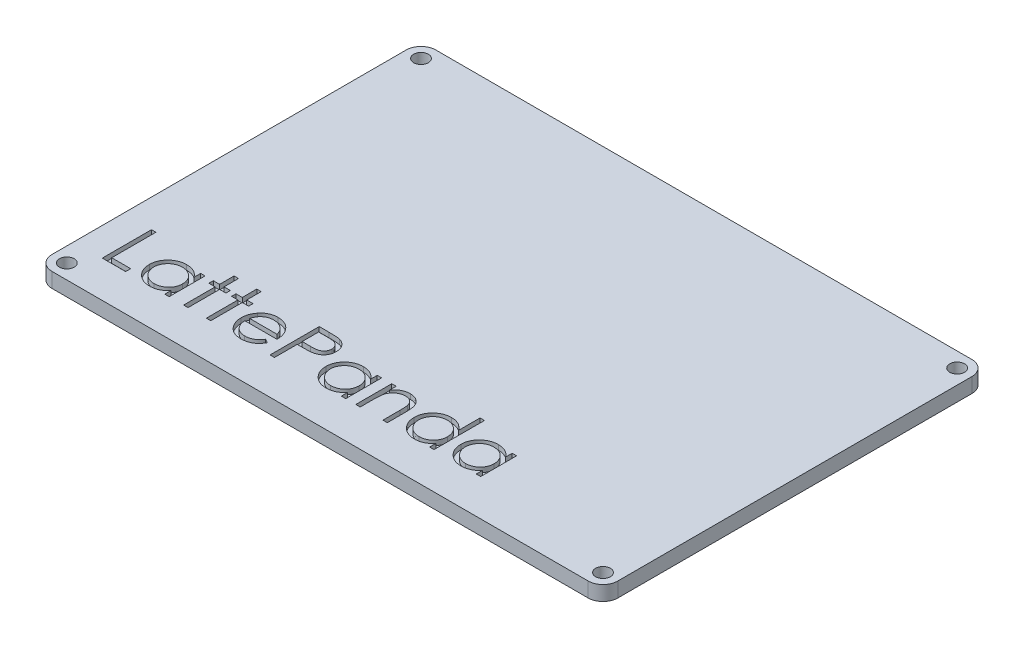
from build123d import *

# Parameters (mm, degrees)
SKETCH1_R           = 1.5
BOSS_EXTRUDE1_DEPTH = 3
CUT_EXTRUDE1_DEPTH  = 1


with BuildPart() as part:
    # Sketch1 → Boss-Extrude1 (new body)
    with BuildSketch(Plane(origin=(0, 0, 0), x_dir=(1, 0, 0), z_dir=(0, 1, 0))):
        with BuildLine():
            Line((-54.5, 39), (54.5, 39))
            ThreePointArc((54.5, 39), (56.621320344, 38.121320344), (57.5, 36))
            Line((57.5, 36), (57.5, -36))
            ThreePointArc((57.5, -36), (56.621320344, -38.121320344), (54.5, -39))
            Line((54.5, -39), (-54.5, -39))
            ThreePointArc((-54.5, -39), (-56.621320344, -38.121320344), (-57.5, -36))
            Line((-57.5, -36), (-57.5, 36))
            ThreePointArc((-57.5, 36), (-56.621320344, 38.121320344), (-54.5, 39))
        make_face()
        with Locations(Location((-54.5, 36, 0), (0, 0, 270))):
            Circle(SKETCH1_R, mode=Mode.SUBTRACT)
        with Locations(Location((54.5, 36, 0), (0, 0, 270))):
            Circle(SKETCH1_R, mode=Mode.SUBTRACT)
        with Locations(Location((54.5, -36, 0), (0, 0, 270))):
            Circle(SKETCH1_R, mode=Mode.SUBTRACT)
        with Locations(Location((-54.5, -36, 0), (0, 0, 270))):
            Circle(SKETCH1_R, mode=Mode.SUBTRACT)
    extrude(amount=BOSS_EXTRUDE1_DEPTH)

    # Sketch2 → Cut-Extrude1 (cut)
    # profile 1 of 10: a face of its own
    with BuildSketch(Plane(origin=(0, 3, 0), x_dir=(1, 0, 0), z_dir=(0, 1, 0))):
        Polygon((-51.748795713, -21.544641821), (-50.851359815, -21.544641821), (-50.851359815, -30.519000795), (-47.005205969, -30.519000795), (-47.005205969, -31.544641821), (-51.748795713, -31.544641821), align=None)
    # profile 2 of 10: a face of its own
    with BuildSketch(Plane(origin=(0, 3, 0), x_dir=(1, 0, 0), z_dir=(0, 1, 0))):
        with BuildLine():
            Line((-38.159052123, -24.236949513), (-38.159052123, -31.544641821))
            Line((-38.159052123, -31.544641821), (-39.056488021, -31.544641821))
            Line((-39.056488021, -31.544641821), (-39.056488021, -30.280619385))
            add(Edge.make_bspline(
                [(-39.056488021, -30.280619385), (-39.157684565, -30.395018224), (-39.355170895, -30.618268999), (-39.68500266, -30.909932349), (-40.034626026, -31.151013268), (-40.402344086, -31.345727313), (-40.787824781, -31.491990331), (-41.190213602, -31.595950785), (-41.60967469, -31.662790314), (-41.89610999, -31.669464663), (-42.041263662, -31.672846949)],
                knots=[0, 0, 0, 0, 1.074387032, 2.096679803, 3.090159297, 4.057316773, 5.018401886, 5.985159533, 6.978961417, 8, 8, 8, 8], degree=3))
            add(Edge.make_bspline(
                [(-42.041263662, -31.672846949), (-42.170314958, -31.669343028), (-42.424809829, -31.662433141), (-42.799178621, -31.608826559), (-43.159442191, -31.522739069), (-43.50594097, -31.403022242), (-43.836432814, -31.244219894), (-44.153747376, -31.054102043), (-44.456240782, -30.827699671), (-44.739302322, -30.568876733), (-44.99996518, -30.287748198), (-45.228711673, -29.987903778), (-45.419434758, -29.670640053), (-45.578920703, -29.339973899), (-45.701767402, -28.993359843), (-45.787406357, -28.631996506), (-45.84095049, -28.256311153), (-45.847857521, -28.000483944), (-45.851359815, -27.870763615)],
                knots=[0, 0, 0, 0, 1.033919861, 2.038935746, 3.024066025, 3.998881131, 4.97069526, 5.957263378, 6.95902576, 7.993208707, 9.027059324, 10.027763471, 11.009749337, 11.988697705, 12.965288445, 13.950418724, 14.960734635, 16, 16, 16, 16], degree=3))
            add(Edge.make_bspline(
                [(-45.851359815, -27.870763615), (-45.847779897, -27.743724462), (-45.840702592, -27.49257491), (-45.787979107, -27.123207201), (-45.699319082, -26.767440742), (-45.57489666, -26.426420904), (-45.415348217, -26.099735047), (-45.221267969, -25.787152118), (-44.992641898, -25.487810983), (-44.729063592, -25.208750335), (-44.443535678, -24.950977151), (-44.138082161, -24.726951307), (-43.820301357, -24.533474596), (-43.485264184, -24.380178949), (-43.137929599, -24.256152936), (-42.775205468, -24.170344456), (-42.398600958, -24.119780681), (-42.142913837, -24.112458498), (-42.01321879, -24.108744385)],
                knots=[0, 0, 0, 0, 1.020392517, 2.01726096, 2.990465484, 3.961182959, 4.928053699, 5.906110375, 6.912531644, 7.948652711, 8.985773172, 9.998621852, 10.987621588, 11.969261332, 12.953316658, 13.946091881, 14.958173133, 16, 16, 16, 16], degree=3))
            add(Edge.make_bspline(
                [(-42.01321879, -24.108744385), (-41.864076335, -24.112852246), (-41.571615021, -24.120907569), (-41.143820709, -24.187943933), (-40.739122201, -24.301196696), (-40.354395481, -24.45524669), (-39.991022092, -24.659957345), (-39.652442136, -24.918185805), (-39.335112184, -25.228303482), (-39.151168494, -25.466504752), (-39.056488021, -25.589112974)],
                knots=[0, 0, 0, 0, 1.038897134, 2.037228247, 3.008116434, 3.962042015, 4.918381754, 5.904844433, 6.921570401, 8, 8, 8, 8], degree=3))
            Line((-39.056488021, -25.589112974), (-39.056488021, -24.236949513))
            Line((-39.056488021, -24.236949513), (-38.159052123, -24.236949513))
        make_face()
        with BuildLine():
            add(Edge.make_bspline(
                [(-42.001199559, -25.006180282), (-42.132383381, -25.010847818), (-42.391319381, -25.020060793), (-42.771445102, -25.091985065), (-43.135197713, -25.211655334), (-43.480757925, -25.375317909), (-43.802667116, -25.581114299), (-44.090363318, -25.830032537), (-44.346199608, -26.115281149), (-44.561366077, -26.435572893), (-44.736767497, -26.778938868), (-44.860101874, -27.137865834), (-44.941442581, -27.505880055), (-44.949752639, -27.755487729), (-44.953923918, -27.880779641)],
                knots=[0, 0, 0, 0, 1.031046209, 2.035121221, 3.029706178, 4.034933723, 5.034054252, 6.02443088, 7.017295772, 8.038157696, 9.050218397, 10.03989886, 11.016116709, 12, 12, 12, 12], degree=3))
            add(Edge.make_bspline(
                [(-44.953923918, -27.880779641), (-44.948595651, -28.005322804), (-44.937960003, -28.253920964), (-44.861529448, -28.622436898), (-44.733301238, -28.981448446), (-44.558323916, -29.327908428), (-44.339219274, -29.649577286), (-44.085251695, -29.940263351), (-43.793965177, -30.190233603), (-43.471315157, -30.399483813), (-43.126720956, -30.568519587), (-42.764338294, -30.6861357), (-42.390979328, -30.762072216), (-42.137115517, -30.77094215), (-42.00921238, -30.775411051)],
                knots=[0, 0, 0, 0, 0.979072187, 1.954306742, 2.945804271, 3.96968567, 4.997920485, 5.998718438, 6.996577872, 8.005894225, 9.015743152, 10.005417472, 10.995077863, 12, 12, 12, 12], degree=3))
            add(Edge.make_bspline(
                [(-42.00921238, -30.775411051), (-41.879365229, -30.770668297), (-41.621112124, -30.76123543), (-41.239858673, -30.689003243), (-40.869873065, -30.569663819), (-40.51619527, -30.404237743), (-40.18672061, -30.199216726), (-39.891012388, -29.959196466), (-39.640966764, -29.680044511), (-39.428987879, -29.373254646), (-39.262772403, -29.036934656), (-39.141697948, -28.678836968), (-39.07011536, -28.298949116), (-39.061093276, -28.039337896), (-39.056488021, -27.906821308)],
                knots=[0, 0, 0, 0, 1.01762866, 2.023962475, 3.030623092, 4.058876274, 5.077231937, 6.066672613, 7.034107872, 8.005628644, 8.981990164, 9.965428785, 10.961468474, 12, 12, 12, 12], degree=3))
            add(Edge.make_bspline(
                [(-39.056488021, -27.906821308), (-39.059229896, -27.805856078), (-39.064626774, -27.607124554), (-39.105856973, -27.315331646), (-39.171442477, -27.036092429), (-39.263860106, -26.769113318), (-39.385263775, -26.515870417), (-39.531685964, -26.274545387), (-39.705701534, -26.046393355), (-39.904509237, -25.834556009), (-40.122124102, -25.641337546), (-40.352394218, -25.468868286), (-40.598047781, -25.327186079), (-40.8549536, -25.209925303), (-41.123557413, -25.116613446), (-41.406044898, -25.054362892), (-41.699413432, -25.011619118), (-41.899545019, -25.008012316), (-42.001199559, -25.006180282)],
                knots=[0, 0, 0, 0, 1.050140795, 2.067009409, 3.05949893, 4.030605086, 5.00011959, 5.97591094, 6.962425594, 7.979863591, 8.993523472, 9.986985069, 10.967611495, 11.937549037, 12.921786183, 13.919465291, 14.943216303, 16, 16, 16, 16], degree=3))
        make_face(mode=Mode.SUBTRACT)
    # profile 3 of 10: a face of its own
    with BuildSketch(Plane(origin=(0, 3, 0), x_dir=(1, 0, 0), z_dir=(0, 1, 0))):
        Polygon((-35.210334174, -21.288231564), (-34.312898277, -21.288231564), (-34.312898277, -24.236949513), (-33.030846995, -24.236949513), (-33.030846995, -25.13438541), (-34.312898277, -25.13438541), (-34.312898277, -31.544641821), (-35.210334174, -31.544641821), (-35.210334174, -25.13438541), (-36.492385456, -25.13438541), (-36.492385456, -24.236949513), (-35.210334174, -24.236949513), align=None)
    # profile 4 of 10: a face of its own
    with BuildSketch(Plane(origin=(0, 3, 0), x_dir=(1, 0, 0), z_dir=(0, 1, 0))):
        Polygon((-30.594949559, -21.288231564), (-29.697513662, -21.288231564), (-29.697513662, -24.236949513), (-28.41546238, -24.236949513), (-28.41546238, -25.13438541), (-29.697513662, -25.13438541), (-29.697513662, -31.544641821), (-30.594949559, -31.544641821), (-30.594949559, -25.13438541), (-31.877000841, -25.13438541), (-31.877000841, -24.236949513), (-30.594949559, -24.236949513), align=None)
    # profile 5 of 10: a face of its own
    with BuildSketch(Plane(origin=(0, 3, 0), x_dir=(1, 0, 0), z_dir=(0, 1, 0))):
        with BuildLine():
            Line((-20.879404687, -29.236949513), (-20.082129046, -29.655619385))
            add(Edge.make_bspline(
                [(-20.082129046, -29.655619385), (-20.145662175, -29.768314617), (-20.269272485, -29.987574911), (-20.481846051, -30.288808798), (-20.704680544, -30.559802271), (-20.947834738, -30.793315569), (-21.204033821, -30.996890955), (-21.474698549, -31.174999026), (-21.761238028, -31.326766227), (-22.063665813, -31.454630592), (-22.384521674, -31.552943432), (-22.724583149, -31.622384064), (-23.084501707, -31.665307688), (-23.331205078, -31.670293805), (-23.457529687, -31.672846949)],
                knots=[0, 0, 0, 0, 1.120438281, 2.179929193, 3.190490725, 4.156257408, 5.095198341, 6.022838206, 6.959905092, 7.901321166, 8.864066838, 9.862729781, 10.905609505, 12, 12, 12, 12], degree=3))
            add(Edge.make_bspline(
                [(-23.457529687, -31.672846949), (-23.597935337, -31.669569305), (-23.871826085, -31.663175571), (-24.270511077, -31.608054244), (-24.645880844, -31.51813322), (-24.997914282, -31.392517387), (-25.325749289, -31.228439318), (-25.630037446, -31.028555084), (-25.912378948, -30.793891499), (-26.163876689, -30.522415947), (-26.390287782, -30.231896069), (-26.590075839, -29.92916497), (-26.757097071, -29.614984329), (-26.892961671, -29.29135426), (-27.002689857, -28.960314564), (-27.079166153, -28.618853228), (-27.123251148, -28.267894416), (-27.130006706, -28.030473457), (-27.133411097, -27.910827718)],
                knots=[0, 0, 0, 0, 1.145258523, 2.234067595, 3.276747158, 4.290159414, 5.277019952, 6.260822364, 7.254936242, 8.264827045, 9.274100331, 10.257902744, 11.220704747, 12.172965371, 13.118907548, 14.062713208, 15.023725156, 16, 16, 16, 16], degree=3))
            add(Edge.make_bspline(
                [(-27.133411097, -27.910827718), (-27.130384979, -27.798556774), (-27.124387613, -27.576050589), (-27.086585363, -27.246720462), (-27.01959024, -26.926639169), (-26.927657886, -26.615540746), (-26.80894004, -26.313946078), (-26.663705128, -26.02167161), (-26.491726906, -25.739028353), (-26.358947838, -25.560733686), (-26.292064944, -25.470923872)],
                knots=[0, 0, 0, 0, 1.024358464, 2.0301432, 3.019427413, 4.004406732, 4.986367066, 5.972626655, 6.978780325, 8, 8, 8, 8], degree=3))
            add(Edge.make_bspline(
                [(-26.292064944, -25.470923872), (-26.201471564, -25.3627271), (-26.023154574, -25.149760956), (-25.721564987, -24.869937168), (-25.394992998, -24.635526382), (-25.047531209, -24.441220279), (-24.675141283, -24.293581287), (-24.282829023, -24.183559624), (-23.866127348, -24.121908164), (-23.581255288, -24.113200067), (-23.435494431, -24.108744385)],
                knots=[0, 0, 0, 0, 1.030682036, 2.02871468, 2.997146059, 3.962720338, 4.930598197, 5.918074684, 6.934738563, 8, 8, 8, 8], degree=3))
            add(Edge.make_bspline(
                [(-23.435494431, -24.108744385), (-23.28564413, -24.112613096), (-22.991671999, -24.120202625), (-22.563008796, -24.190563578), (-22.157406748, -24.302142305), (-21.775028165, -24.459724564), (-21.415834277, -24.663037569), (-21.082159849, -24.914871401), (-20.768298385, -25.207494508), (-20.585702445, -25.432532249), (-20.492786097, -25.547045667)],
                knots=[0, 0, 0, 0, 1.056321875, 2.072262726, 3.055038591, 4.01806755, 4.982017516, 5.957941055, 6.960871419, 8, 8, 8, 8], degree=3))
            add(Edge.make_bspline(
                [(-20.492786097, -25.547045667), (-20.429566274, -25.633341613), (-20.303547436, -25.805359095), (-20.145698579, -26.085848116), (-20.008677451, -26.379306957), (-19.899154705, -26.690479234), (-19.810470416, -27.015678035), (-19.746308076, -27.357228162), (-19.708680595, -27.715027909), (-19.701284317, -27.958818068), (-19.697513662, -28.083103359)],
                knots=[0, 0, 0, 0, 0.94817472, 1.890038105, 2.849395472, 3.817997239, 4.812318967, 5.836947057, 6.897266129, 8, 8, 8, 8], degree=3))
            Line((-19.697513662, -28.083103359), (-26.2359752, -28.083103359))
            add(Edge.make_bspline(
                [(-26.2359752, -28.083103359), (-26.231576325, -28.1793904), (-26.222926113, -28.368734982), (-26.182597133, -28.645794362), (-26.119029208, -28.909718197), (-26.029689029, -29.158526888), (-25.921498042, -29.39547011), (-25.788967423, -29.618790215), (-25.630854412, -29.827470015), (-25.454495271, -30.023376123), (-25.258189284, -30.19783544), (-25.051667149, -30.353983373), (-24.831971249, -30.484856506), (-24.600833868, -30.591084762), (-24.358628767, -30.674245666), (-24.105279638, -30.731010867), (-23.84128502, -30.769031173), (-23.66132578, -30.773258788), (-23.569709174, -30.775411051)],
                knots=[0, 0, 0, 0, 1.094153842, 2.151609401, 3.174256925, 4.172055639, 5.149267565, 6.128595816, 7.11444997, 8.118368179, 9.117203808, 10.09244225, 11.054858984, 12.015122123, 12.976791628, 13.957293641, 14.960065497, 16, 16, 16, 16], degree=3))
            add(Edge.make_bspline(
                [(-23.569709174, -30.775411051), (-23.480134467, -30.773673747), (-23.302401064, -30.770226601), (-23.0377129, -30.736706855), (-22.777314251, -30.682506068), (-22.52228287, -30.608534667), (-22.277794739, -30.51831509), (-22.051378881, -30.409449782), (-21.843149694, -30.289021935), (-21.648529789, -30.151280006), (-21.459755523, -29.982685186), (-21.272491276, -29.772297412), (-21.071700838, -29.523475904), (-20.946016287, -29.336202572), (-20.879404687, -29.236949513)],
                knots=[0, 0, 0, 0, 0.99110716, 1.966546729, 2.947904876, 3.932708344, 4.903319531, 5.828989031, 6.710028674, 7.56322171, 8.463672341, 9.504779593, 10.677557249, 12, 12, 12, 12], degree=3))
        make_face()
        with BuildLine():
            add(Edge.make_bspline(
                [(-20.594949559, -27.185667462), (-20.627797058, -27.066630679), (-20.691017919, -26.837523192), (-20.823121818, -26.520263505), (-20.971897648, -26.238298074), (-21.147959738, -25.993784836), (-21.347441811, -25.776631942), (-21.577856619, -25.586864556), (-21.836244886, -25.41710041), (-22.121271002, -25.273807554), (-22.423104674, -25.151836529), (-22.739122365, -25.070050484), (-23.061573187, -25.014023221), (-23.279671148, -25.008805768), (-23.389420713, -25.006180282)],
                knots=[0, 0, 0, 0, 1.154881502, 2.222775134, 3.210006277, 4.132804581, 5.035138423, 5.962687519, 6.919655026, 7.923214229, 8.944639381, 9.960483929, 10.97369054, 12, 12, 12, 12], degree=3))
            add(Edge.make_bspline(
                [(-23.389420713, -25.006180282), (-23.478990537, -25.007927915), (-23.656051249, -25.011382618), (-23.916911444, -25.044154416), (-24.167424869, -25.098325401), (-24.409439977, -25.172510992), (-24.639785315, -25.271392713), (-24.863198938, -25.387344789), (-25.07400007, -25.528892172), (-25.205832343, -25.636774614), (-25.272433533, -25.691276436)],
                knots=[0, 0, 0, 0, 1.04873581, 2.073130211, 3.073294108, 4.04793562, 5.032784715, 6.005352987, 6.992311501, 8, 8, 8, 8], degree=3))
            add(Edge.make_bspline(
                [(-25.272433533, -25.691276436), (-25.320128625, -25.734403052), (-25.416651865, -25.821680812), (-25.545624784, -25.972049974), (-25.669111849, -26.134197294), (-25.781493714, -26.314326222), (-25.884572532, -26.51038559), (-25.98102961, -26.720721691), (-26.06784793, -26.946930634), (-26.116693959, -27.104566175), (-26.141824559, -27.185667462)],
                knots=[0, 0, 0, 0, 0.879870761, 1.780643979, 2.707998968, 3.669668524, 4.684282772, 5.740141944, 6.837334558, 8, 8, 8, 8], degree=3))
            Line((-26.141824559, -27.185667462), (-20.594949559, -27.185667462))
        make_face(mode=Mode.SUBTRACT)
    # profile 6 of 10: a face of its own
    with BuildSketch(Plane(origin=(0, 3, 0), x_dir=(1, 0, 0), z_dir=(0, 1, 0))):
        with BuildLine():
            Line((-17.64623161, -21.544641821), (-15.68509379, -21.544641821))
            add(Edge.make_bspline(
                [(-15.68509379, -21.544641821), (-15.550205486, -21.544790095), (-15.291753507, -21.545074197), (-14.921139062, -21.553687756), (-14.584539829, -21.565192591), (-14.282681598, -21.581140857), (-14.014635603, -21.599988258), (-13.781614747, -21.626422656), (-13.581787444, -21.654023501), (-13.462054731, -21.682084662), (-13.407449559, -21.694882205)],
                knots=[0, 0, 0, 0, 1.415646017, 2.712440637, 3.8905458, 4.950247383, 5.884950622, 6.709939814, 7.411656543, 8, 8, 8, 8], degree=3))
            add(Edge.make_bspline(
                [(-13.407449559, -21.694882205), (-13.338325177, -21.713802062), (-13.201705242, -21.751195952), (-13.004845119, -21.826092305), (-12.817548417, -21.914898491), (-12.639172536, -22.016109748), (-12.471909442, -22.134068503), (-12.31326361, -22.263993125), (-12.164635095, -22.408883321), (-12.02685969, -22.567114006), (-11.900331697, -22.736028892), (-11.791389746, -22.918149548), (-11.700169097, -23.110410415), (-11.621931179, -23.312677762), (-11.565621309, -23.526650114), (-11.523201595, -23.750840721), (-11.496276945, -23.98522555), (-11.493698197, -24.1453966), (-11.492385456, -24.226933487)],
                knots=[0, 0, 0, 0, 0.999701418, 1.975846123, 2.934577507, 3.890451536, 4.834027766, 5.787354733, 6.749476667, 7.726910423, 8.712836071, 9.690891519, 10.682875813, 11.679750201, 12.712814741, 13.765529915, 14.8625177, 16, 16, 16, 16], degree=3))
            add(Edge.make_bspline(
                [(-11.492385456, -24.226933487), (-11.493589527, -24.309155707), (-11.495945373, -24.470029032), (-11.524220474, -24.705379856), (-11.562306735, -24.930289542), (-11.620869742, -25.1442594), (-11.697571665, -25.346018744), (-11.787548959, -25.538650836), (-11.896073331, -25.71887847), (-12.020772845, -25.887355948), (-12.159491686, -26.044241412), (-12.311642938, -26.188397968), (-12.476612345, -26.318981792), (-12.653875625, -26.436285631), (-12.845160908, -26.537589287), (-13.047567061, -26.628324444), (-13.262853393, -26.704527474), (-13.411832005, -26.744613364), (-13.487577764, -26.764994385)],
                knots=[0, 0, 0, 0, 1.121902311, 2.195077645, 3.232258892, 4.234102512, 5.217864754, 6.176164875, 7.132989551, 8.084763148, 9.034132444, 9.988522005, 10.94243251, 11.903244335, 12.886203696, 13.894208494, 14.929344452, 16, 16, 16, 16], degree=3))
            add(Edge.make_bspline(
                [(-13.487577764, -26.764994385), (-13.55022729, -26.778317188), (-13.687527368, -26.807514885), (-13.913649431, -26.840110476), (-14.176921963, -26.867932193), (-14.476985619, -26.888792586), (-14.813571062, -26.906650781), (-15.186860369, -26.920845335), (-15.597586304, -26.928644918), (-15.884075572, -26.929047183), (-16.033651482, -26.929257205)],
                knots=[0, 0, 0, 0, 0.601384939, 1.31797006, 2.144135048, 3.087295005, 4.142315834, 5.309527816, 6.595305764, 8, 8, 8, 8], degree=3))
            Line((-16.033651482, -26.929257205), (-16.748795713, -26.929257205))
            Line((-16.748795713, -26.929257205), (-16.748795713, -31.544641821))
            Line((-16.748795713, -31.544641821), (-17.64623161, -31.544641821))
            Line((-17.64623161, -31.544641821), (-17.64623161, -21.544641821))
        make_face()
        with BuildLine():
            Line((-16.748795713, -22.570282846), (-16.748795713, -25.903616179))
            Line((-16.748795713, -25.903616179), (-14.997994431, -25.925651436))
            add(Edge.make_bspline(
                [(-14.997994431, -25.925651436), (-14.912508928, -25.925695618), (-14.747480929, -25.925780909), (-14.509091719, -25.914394557), (-14.287922327, -25.901250178), (-14.084652112, -25.882004682), (-13.899189442, -25.854801089), (-13.731225074, -25.827338981), (-13.582061408, -25.787609373), (-13.40749226, -25.73411489), (-13.21296841, -25.642878845), (-13.001346843, -25.510450588), (-12.822002311, -25.341648565), (-12.666807177, -25.151854761), (-12.543647526, -24.940714391), (-12.453487548, -24.714803143), (-12.400512812, -24.476437859), (-12.393409402, -24.313328891), (-12.389821354, -24.230939897)],
                knots=[0, 0, 0, 0, 1.160613943, 2.240541288, 3.23993089, 4.169200891, 5.011653406, 5.7853311, 6.478053781, 7.106038997, 8.262395093, 9.384106736, 10.481365981, 11.59014053, 12.70357646, 13.786202915, 14.881775077, 16, 16, 16, 16], degree=3))
            add(Edge.make_bspline(
                [(-12.389821354, -24.230939897), (-12.393428915, -24.150544145), (-12.400600301, -23.990727339), (-12.453902767, -23.756502308), (-12.543472235, -23.532971724), (-12.667633934, -23.324477195), (-12.818322877, -23.135366326), (-12.993463857, -22.97108882), (-13.192644604, -22.839026813), (-13.377925264, -22.753788865), (-13.542500081, -22.701745221), (-13.685448538, -22.665331391), (-13.846850465, -22.63625823), (-14.026758406, -22.612716794), (-14.223777932, -22.592564047), (-14.439601688, -22.578889827), (-14.673412098, -22.570885666), (-14.835728015, -22.570488651), (-14.919869431, -22.570282846)],
                knots=[0, 0, 0, 0, 1.120700087, 2.227813068, 3.331159281, 4.466773991, 5.599788987, 6.693661531, 7.80175334, 8.91857717, 9.525282508, 10.207424825, 10.974604443, 11.810962634, 12.737642355, 13.736264703, 14.826523623, 16, 16, 16, 16], degree=3))
            Line((-14.919869431, -22.570282846), (-16.748795713, -22.570282846))
        make_face(mode=Mode.SUBTRACT)
    # profile 7 of 10: a face of its own
    with BuildSketch(Plane(origin=(0, 3, 0), x_dir=(1, 0, 0), z_dir=(0, 1, 0))):
        with BuildLine():
            Line((-2.261616226, -24.236949513), (-2.261616226, -31.544641821))
            Line((-2.261616226, -31.544641821), (-3.159052123, -31.544641821))
            Line((-3.159052123, -31.544641821), (-3.159052123, -30.280619385))
            add(Edge.make_bspline(
                [(-3.159052123, -30.280619385), (-3.260248668, -30.395018224), (-3.457734997, -30.618268999), (-3.787566763, -30.909932349), (-4.137190128, -31.151013268), (-4.504908189, -31.345727313), (-4.890388884, -31.491990331), (-5.292777705, -31.595950785), (-5.712238793, -31.662790314), (-5.998674092, -31.669464663), (-6.143827764, -31.672846949)],
                knots=[0, 0, 0, 0, 1.074387032, 2.096679803, 3.090159297, 4.057316773, 5.018401886, 5.985159533, 6.978961417, 8, 8, 8, 8], degree=3))
            add(Edge.make_bspline(
                [(-6.143827764, -31.672846949), (-6.272879061, -31.669343028), (-6.527373932, -31.662433141), (-6.901742724, -31.608826559), (-7.262006294, -31.522739069), (-7.608505073, -31.403022242), (-7.938996917, -31.244219894), (-8.256311479, -31.054102043), (-8.558804884, -30.827699671), (-8.841866424, -30.568876733), (-9.102529283, -30.287748198), (-9.331275776, -29.987903778), (-9.521998861, -29.670640053), (-9.681484806, -29.339973899), (-9.804331504, -28.993359843), (-9.889970459, -28.631996506), (-9.943514593, -28.256311153), (-9.950421623, -28.000483944), (-9.953923918, -27.870763615)],
                knots=[0, 0, 0, 0, 1.033919861, 2.038935746, 3.024066025, 3.998881131, 4.97069526, 5.957263378, 6.95902576, 7.993208707, 9.027059324, 10.027763471, 11.009749337, 11.988697705, 12.965288445, 13.950418724, 14.960734635, 16, 16, 16, 16], degree=3))
            add(Edge.make_bspline(
                [(-9.953923918, -27.870763615), (-9.950344, -27.743724462), (-9.943266694, -27.49257491), (-9.890543209, -27.123207201), (-9.801883184, -26.767440742), (-9.677460763, -26.426420904), (-9.51791232, -26.099735047), (-9.323832071, -25.787152118), (-9.095206001, -25.487810983), (-8.831627695, -25.208750335), (-8.54609978, -24.950977151), (-8.240646263, -24.726951307), (-7.922865459, -24.533474596), (-7.587828287, -24.380178949), (-7.240493701, -24.256152936), (-6.877769571, -24.170344456), (-6.50116506, -24.119780681), (-6.24547794, -24.112458498), (-6.115782892, -24.108744385)],
                knots=[0, 0, 0, 0, 1.020392517, 2.01726096, 2.990465484, 3.961182959, 4.928053699, 5.906110375, 6.912531644, 7.948652711, 8.985773172, 9.998621852, 10.987621588, 11.969261332, 12.953316658, 13.946091881, 14.958173133, 16, 16, 16, 16], degree=3))
            add(Edge.make_bspline(
                [(-6.115782892, -24.108744385), (-5.966640438, -24.112852246), (-5.674179124, -24.120907569), (-5.246384811, -24.187943933), (-4.841686303, -24.301196696), (-4.456959583, -24.45524669), (-4.093586194, -24.659957345), (-3.755006239, -24.918185805), (-3.437676287, -25.228303482), (-3.253732596, -25.466504752), (-3.159052123, -25.589112974)],
                knots=[0, 0, 0, 0, 1.038897134, 2.037228247, 3.008116434, 3.962042015, 4.918381754, 5.904844433, 6.921570401, 8, 8, 8, 8], degree=3))
            Line((-3.159052123, -25.589112974), (-3.159052123, -24.236949513))
            Line((-3.159052123, -24.236949513), (-2.261616226, -24.236949513))
        make_face()
        with BuildLine():
            add(Edge.make_bspline(
                [(-6.103763662, -25.006180282), (-6.234947484, -25.010847818), (-6.493883484, -25.020060793), (-6.874009204, -25.091985065), (-7.237761816, -25.211655334), (-7.583322028, -25.375317909), (-7.905231218, -25.581114299), (-8.192927421, -25.830032537), (-8.44876371, -26.115281149), (-8.66393018, -26.435572893), (-8.839331599, -26.778938868), (-8.962665976, -27.137865834), (-9.044006683, -27.505880055), (-9.052316742, -27.755487729), (-9.056488021, -27.880779641)],
                knots=[0, 0, 0, 0, 1.031046209, 2.035121221, 3.029706178, 4.034933723, 5.034054252, 6.02443088, 7.017295772, 8.038157696, 9.050218397, 10.03989886, 11.016116709, 12, 12, 12, 12], degree=3))
            add(Edge.make_bspline(
                [(-9.056488021, -27.880779641), (-9.051159754, -28.005322804), (-9.040524106, -28.253920964), (-8.96409355, -28.622436898), (-8.835865341, -28.981448446), (-8.660888018, -29.327908428), (-8.441783376, -29.649577286), (-8.187815798, -29.940263351), (-7.89652928, -30.190233603), (-7.573879259, -30.399483813), (-7.229285058, -30.568519587), (-6.866902397, -30.6861357), (-6.493543431, -30.762072216), (-6.23967962, -30.77094215), (-6.111776482, -30.775411051)],
                knots=[0, 0, 0, 0, 0.979072187, 1.954306742, 2.945804271, 3.96968567, 4.997920485, 5.998718438, 6.996577872, 8.005894225, 9.015743152, 10.005417472, 10.995077863, 12, 12, 12, 12], degree=3))
            add(Edge.make_bspline(
                [(-6.111776482, -30.775411051), (-5.981929331, -30.770668297), (-5.723676227, -30.76123543), (-5.342422776, -30.689003243), (-4.972437168, -30.569663819), (-4.618759373, -30.404237743), (-4.289284712, -30.199216726), (-3.99357649, -29.959196466), (-3.743530866, -29.680044511), (-3.531551982, -29.373254646), (-3.365336506, -29.036934656), (-3.244262051, -28.678836968), (-3.172679463, -28.298949116), (-3.163657378, -28.039337896), (-3.159052123, -27.906821308)],
                knots=[0, 0, 0, 0, 1.01762866, 2.023962475, 3.030623092, 4.058876274, 5.077231937, 6.066672613, 7.034107872, 8.005628644, 8.981990164, 9.965428785, 10.961468474, 12, 12, 12, 12], degree=3))
            add(Edge.make_bspline(
                [(-3.159052123, -27.906821308), (-3.161793998, -27.805856078), (-3.167190877, -27.607124554), (-3.208421075, -27.315331646), (-3.27400658, -27.036092429), (-3.366424208, -26.769113318), (-3.487827878, -26.515870417), (-3.634250066, -26.274545387), (-3.808265637, -26.046393355), (-4.00707334, -25.834556009), (-4.224688204, -25.641337546), (-4.45495832, -25.468868286), (-4.700611883, -25.327186079), (-4.957517703, -25.209925303), (-5.226121516, -25.116613446), (-5.508609001, -25.054362892), (-5.801977535, -25.011619118), (-6.002109122, -25.008012316), (-6.103763662, -25.006180282)],
                knots=[0, 0, 0, 0, 1.050140795, 2.067009409, 3.05949893, 4.030605086, 5.00011959, 5.97591094, 6.962425594, 7.979863591, 8.993523472, 9.986985069, 10.967611495, 11.937549037, 12.921786183, 13.919465291, 14.943216303, 16, 16, 16, 16], degree=3))
        make_face(mode=Mode.SUBTRACT)
    # profile 8 of 10: a face of its own
    with BuildSketch(Plane(origin=(0, 3, 0), x_dir=(1, 0, 0), z_dir=(0, 1, 0))):
        with BuildLine():
            Line((-0.210334174, -24.236949513), (0.687101723, -24.236949513))
            Line((0.687101723, -24.236949513), (0.687101723, -25.555058487))
            add(Edge.make_bspline(
                [(0.687101723, -25.555058487), (0.782923538, -25.435507851), (0.968869112, -25.203515669), (1.278538636, -24.898599742), (1.605806922, -24.64732767), (1.94866979, -24.447031116), (2.307592676, -24.296040756), (2.680387733, -24.186995238), (3.069286893, -24.121610014), (3.333756712, -24.113066499), (3.467550441, -24.108744385)],
                knots=[0, 0, 0, 0, 1.12780773, 2.188550248, 3.19190651, 4.159438251, 5.104880172, 6.052711206, 7.014878035, 8, 8, 8, 8], degree=3))
            add(Edge.make_bspline(
                [(3.467550441, -24.108744385), (3.602780824, -24.113730657), (3.867459304, -24.123489996), (4.252825193, -24.200680542), (4.612749175, -24.332524128), (4.945947906, -24.513130043), (5.246311373, -24.737719967), (5.510096663, -24.999370772), (5.728277369, -25.30033101), (5.874555549, -25.579540028), (5.970914543, -25.827222297), (6.031578364, -26.039355869), (6.083095454, -26.275693444), (6.127757591, -26.535520841), (6.157977911, -26.820658527), (6.18181303, -27.129937648), (6.198895013, -27.46325802), (6.199572748, -27.693791242), (6.199922236, -27.812670667)],
                knots=[0, 0, 0, 0, 1.235846778, 2.418850247, 3.575807741, 4.728682307, 5.871620074, 6.994088408, 8.11269785, 9.256955736, 9.865816715, 10.540099792, 11.271859618, 12.076849838, 12.949306005, 13.892391288, 14.913166135, 16, 16, 16, 16], degree=3))
            Line((6.199922236, -27.812670667), (6.199922236, -31.544641821))
            Line((6.199922236, -31.544641821), (5.302486338, -31.544641821))
            Line((5.302486338, -31.544641821), (5.302486338, -28.107141821))
            add(Edge.make_bspline(
                [(5.302486338, -28.107141821), (5.301934316, -28.007649121), (5.30087839, -27.817336519), (5.297547971, -27.544853595), (5.289519952, -27.297749085), (5.278239058, -27.07661375), (5.261727542, -26.881659931), (5.244520024, -26.712490569), (5.223477233, -26.569320448), (5.204726052, -26.483134498), (5.196316467, -26.444481564)],
                knots=[0, 0, 0, 0, 1.430800155, 2.736877192, 3.918605307, 4.986035426, 5.920637409, 6.731861385, 7.431261377, 8, 8, 8, 8], degree=3))
            add(Edge.make_bspline(
                [(5.196316467, -26.444481564), (5.165957805, -26.331021036), (5.107526775, -26.112644622), (4.963143966, -25.816432186), (4.780817735, -25.564437364), (4.558252451, -25.358218159), (4.297597949, -25.197730055), (3.999577541, -25.086375898), (3.667067139, -25.016729415), (3.433197475, -25.009794752), (3.311300441, -25.006180282)],
                knots=[0, 0, 0, 0, 1.084156227, 2.086665306, 3.027808233, 3.945421172, 4.874247719, 5.839848303, 6.874090471, 8, 8, 8, 8], degree=3))
            add(Edge.make_bspline(
                [(3.311300441, -25.006180282), (3.239107059, -25.007540295), (3.096238222, -25.010231727), (2.88438116, -25.037235435), (2.678883522, -25.081402451), (2.477682925, -25.14102713), (2.284803514, -25.222919328), (2.094048396, -25.315860385), (1.912600499, -25.43171242), (1.736590793, -25.560828481), (1.572839914, -25.70391193), (1.420473233, -25.854896245), (1.284650318, -26.015683684), (1.16159696, -26.183683534), (1.05537335, -26.361203071), (0.962650241, -26.546529661), (0.883976828, -26.739907229), (0.844883421, -26.87412169), (0.825322877, -26.941276436)],
                knots=[0, 0, 0, 0, 1.023777757, 2.026029729, 3.023749952, 4.003683103, 4.997618607, 5.993177895, 7.010360494, 8.046726602, 9.087585522, 10.09234134, 11.086953743, 12.070360549, 13.043493632, 14.017870808, 15.008233677, 16, 16, 16, 16], degree=3))
            add(Edge.make_bspline(
                [(0.825322877, -26.941276436), (0.814066738, -26.990577016), (0.789562713, -27.0979018), (0.763096485, -27.274028713), (0.739074841, -27.477771498), (0.718969245, -27.708892404), (0.706668055, -27.968200619), (0.693255492, -28.254588727), (0.688372461, -28.569198694), (0.687537164, -28.788232101), (0.687101723, -28.902414256)],
                knots=[0, 0, 0, 0, 0.615963638, 1.340920617, 2.168419149, 3.115676021, 4.16674242, 5.331190069, 6.6087489, 8, 8, 8, 8], degree=3))
            Line((0.687101723, -28.902414256), (0.687101723, -31.544641821))
            Line((0.687101723, -31.544641821), (-0.210334174, -31.544641821))
            Line((-0.210334174, -31.544641821), (-0.210334174, -24.236949513))
        make_face()
    # profile 9 of 10: a face of its own
    with BuildSketch(Plane(origin=(0, 3, 0), x_dir=(1, 0, 0), z_dir=(0, 1, 0))):
        with BuildLine():
            Line((15.687101723, -21.288231564), (15.687101723, -31.544641821))
            Line((15.687101723, -31.544641821), (14.789665826, -31.544641821))
            Line((14.789665826, -31.544641821), (14.789665826, -30.280619385))
            add(Edge.make_bspline(
                [(14.789665826, -30.280619385), (14.688469281, -30.395018224), (14.490982952, -30.618268999), (14.161151186, -30.909932349), (13.811527821, -31.151013268), (13.44380976, -31.345727313), (13.058329065, -31.491990331), (12.655940244, -31.595950785), (12.236479156, -31.662790314), (11.950043857, -31.669464663), (11.804890185, -31.672846949)],
                knots=[0, 0, 0, 0, 1.074387032, 2.096679803, 3.090159297, 4.057316773, 5.018401886, 5.985159533, 6.978961417, 8, 8, 8, 8], degree=3))
            add(Edge.make_bspline(
                [(11.804890185, -31.672846949), (11.675838888, -31.669343028), (11.421344017, -31.662433141), (11.046975225, -31.608826559), (10.686711655, -31.522739069), (10.340212876, -31.403022242), (10.009721032, -31.244219894), (9.69240647, -31.054102043), (9.389913064, -30.827699671), (9.106851524, -30.568876733), (8.846188666, -30.287748198), (8.617442173, -29.987903778), (8.426719088, -29.670640053), (8.267233143, -29.339973899), (8.144386444, -28.993359843), (8.058747489, -28.631996506), (8.005203356, -28.256311153), (7.998296325, -28.000483944), (7.994794031, -27.870763615)],
                knots=[0, 0, 0, 0, 1.033919861, 2.038935746, 3.024066025, 3.998881131, 4.97069526, 5.957263378, 6.95902576, 7.993208707, 9.027059324, 10.027763471, 11.009749337, 11.988697705, 12.965288445, 13.950418724, 14.960734635, 16, 16, 16, 16], degree=3))
            add(Edge.make_bspline(
                [(7.994794031, -27.870763615), (7.998373949, -27.743724462), (8.005451254, -27.49257491), (8.058174739, -27.123207201), (8.146834764, -26.767440742), (8.271257186, -26.426420904), (8.430805629, -26.099735047), (8.624885878, -25.787152118), (8.853511948, -25.487810983), (9.117090254, -25.208750335), (9.402618169, -24.950977151), (9.708071685, -24.726951307), (10.025852489, -24.533474596), (10.360889662, -24.380178949), (10.708224247, -24.256152936), (11.070948378, -24.170344456), (11.447552889, -24.119780681), (11.703240009, -24.112458498), (11.832935056, -24.108744385)],
                knots=[0, 0, 0, 0, 1.020392517, 2.01726096, 2.990465484, 3.961182959, 4.928053699, 5.906110375, 6.912531644, 7.948652711, 8.985773172, 9.998621852, 10.987621588, 11.969261332, 12.953316658, 13.946091881, 14.958173133, 16, 16, 16, 16], degree=3))
            add(Edge.make_bspline(
                [(11.832935056, -24.108744385), (11.982125936, -24.113221802), (12.274971052, -24.122010474), (12.703252542, -24.195457237), (13.108360001, -24.318779745), (13.492625679, -24.487611978), (13.853758708, -24.707042695), (14.194406253, -24.972046832), (14.508644318, -25.290124392), (14.694563811, -25.529014602), (14.789665826, -25.651212333)],
                knots=[0, 0, 0, 0, 1.031072012, 2.023879775, 2.993683497, 3.952812103, 4.918022106, 5.908088563, 6.929940113, 8, 8, 8, 8], degree=3))
            Line((14.789665826, -25.651212333), (14.789665826, -21.288231564))
            Line((14.789665826, -21.288231564), (15.687101723, -21.288231564))
        make_face()
        with BuildLine():
            add(Edge.make_bspline(
                [(11.844954287, -25.006180282), (11.713770465, -25.010847818), (11.454834465, -25.020060793), (11.074708745, -25.091985065), (10.710956133, -25.211655334), (10.365395921, -25.375317909), (10.04348673, -25.581114299), (9.755790528, -25.830032537), (9.499954238, -26.115281149), (9.284787769, -26.435572893), (9.109386349, -26.778938868), (8.986051972, -27.137865834), (8.904711266, -27.505880055), (8.896401207, -27.755487729), (8.892229928, -27.880779641)],
                knots=[0, 0, 0, 0, 1.031046209, 2.035121221, 3.029706178, 4.034933723, 5.034054252, 6.02443088, 7.017295772, 8.038157696, 9.050218397, 10.03989886, 11.016116709, 12, 12, 12, 12], degree=3))
            add(Edge.make_bspline(
                [(8.892229928, -27.880779641), (8.897558195, -28.005322804), (8.908193843, -28.253920964), (8.984624398, -28.622436898), (9.112852608, -28.981448446), (9.28782993, -29.327908428), (9.506934572, -29.649577286), (9.760902151, -29.940263351), (10.052188669, -30.190233603), (10.374838689, -30.399483813), (10.71943289, -30.568519587), (11.081815552, -30.6861357), (11.455174518, -30.762072216), (11.709038329, -30.77094215), (11.836941467, -30.775411051)],
                knots=[0, 0, 0, 0, 0.979072187, 1.954306742, 2.945804271, 3.96968567, 4.997920485, 5.998718438, 6.996577872, 8.005894225, 9.015743152, 10.005417472, 10.995077863, 12, 12, 12, 12], degree=3))
            add(Edge.make_bspline(
                [(11.836941467, -30.775411051), (11.966788617, -30.770668297), (12.225041722, -30.76123543), (12.606295173, -30.689003243), (12.976280781, -30.569663819), (13.329958576, -30.404237743), (13.659433237, -30.199216726), (13.955141458, -29.959196466), (14.205187082, -29.680044511), (14.417165967, -29.373254646), (14.583381443, -29.036934656), (14.704455898, -28.678836968), (14.776038486, -28.298949116), (14.785060571, -28.039337896), (14.789665826, -27.906821308)],
                knots=[0, 0, 0, 0, 1.01762866, 2.023962475, 3.030623092, 4.058876274, 5.077231937, 6.066672613, 7.034107872, 8.005628644, 8.981990164, 9.965428785, 10.961468474, 12, 12, 12, 12], degree=3))
            add(Edge.make_bspline(
                [(14.789665826, -27.906821308), (14.78692395, -27.805856078), (14.781527072, -27.607124554), (14.740296873, -27.315331646), (14.674711369, -27.036092429), (14.582293741, -26.769113318), (14.460890071, -26.515870417), (14.314467883, -26.274545387), (14.140452312, -26.046393355), (13.941644609, -25.834556009), (13.724029744, -25.641337546), (13.493759628, -25.468868286), (13.248106066, -25.327186079), (12.991200246, -25.209925303), (12.722596433, -25.116613446), (12.440108948, -25.054362892), (12.146740414, -25.011619118), (11.946608827, -25.008012316), (11.844954287, -25.006180282)],
                knots=[0, 0, 0, 0, 1.050140795, 2.067009409, 3.05949893, 4.030605086, 5.00011959, 5.97591094, 6.962425594, 7.979863591, 8.993523472, 9.986985069, 10.967611495, 11.937549037, 12.921786183, 13.919465291, 14.943216303, 16, 16, 16, 16], degree=3))
        make_face(mode=Mode.SUBTRACT)
    # profile 10 of 10: a face of its own
    with BuildSketch(Plane(origin=(0, 3, 0), x_dir=(1, 0, 0), z_dir=(0, 1, 0))):
        with BuildLine():
            Line((25.17428121, -24.236949513), (25.17428121, -31.544641821))
            Line((25.17428121, -31.544641821), (24.276845313, -31.544641821))
            Line((24.276845313, -31.544641821), (24.276845313, -30.280619385))
            add(Edge.make_bspline(
                [(24.276845313, -30.280619385), (24.175648768, -30.395018224), (23.978162439, -30.618268999), (23.648330673, -30.909932349), (23.298707308, -31.151013268), (22.930989247, -31.345727313), (22.545508552, -31.491990331), (22.143119731, -31.595950785), (21.723658643, -31.662790314), (21.437223344, -31.669464663), (21.292069672, -31.672846949)],
                knots=[0, 0, 0, 0, 1.074387032, 2.096679803, 3.090159297, 4.057316773, 5.018401886, 5.985159533, 6.978961417, 8, 8, 8, 8], degree=3))
            add(Edge.make_bspline(
                [(21.292069672, -31.672846949), (21.163018375, -31.669343028), (20.908523504, -31.662433141), (20.534154712, -31.608826559), (20.173891142, -31.522739069), (19.827392363, -31.403022242), (19.496900519, -31.244219894), (19.179585957, -31.054102043), (18.877092551, -30.827699671), (18.594031012, -30.568876733), (18.333368153, -30.287748198), (18.10462166, -29.987903778), (17.913898575, -29.670640053), (17.75441263, -29.339973899), (17.631565932, -28.993359843), (17.545926977, -28.631996506), (17.492382843, -28.256311153), (17.485475813, -28.000483944), (17.481973518, -27.870763615)],
                knots=[0, 0, 0, 0, 1.033919861, 2.038935746, 3.024066025, 3.998881131, 4.97069526, 5.957263378, 6.95902576, 7.993208707, 9.027059324, 10.027763471, 11.009749337, 11.988697705, 12.965288445, 13.950418724, 14.960734635, 16, 16, 16, 16], degree=3))
            add(Edge.make_bspline(
                [(17.481973518, -27.870763615), (17.485553436, -27.743724462), (17.492630741, -27.49257491), (17.545354227, -27.123207201), (17.634014251, -26.767440742), (17.758436673, -26.426420904), (17.917985116, -26.099735047), (18.112065365, -25.787152118), (18.340691435, -25.487810983), (18.604269741, -25.208750335), (18.889797656, -24.950977151), (19.195251173, -24.726951307), (19.513031976, -24.533474596), (19.848069149, -24.380178949), (20.195403735, -24.256152936), (20.558127865, -24.170344456), (20.934732376, -24.119780681), (21.190419496, -24.112458498), (21.320114544, -24.108744385)],
                knots=[0, 0, 0, 0, 1.020392517, 2.01726096, 2.990465484, 3.961182959, 4.928053699, 5.906110375, 6.912531644, 7.948652711, 8.985773172, 9.998621852, 10.987621588, 11.969261332, 12.953316658, 13.946091881, 14.958173133, 16, 16, 16, 16], degree=3))
            add(Edge.make_bspline(
                [(21.320114544, -24.108744385), (21.469256998, -24.112852246), (21.761718312, -24.120907569), (22.189512624, -24.187943933), (22.594211133, -24.301196696), (22.978937853, -24.45524669), (23.342311242, -24.659957345), (23.680891197, -24.918185805), (23.998221149, -25.228303482), (24.18216484, -25.466504752), (24.276845313, -25.589112974)],
                knots=[0, 0, 0, 0, 1.038897134, 2.037228247, 3.008116434, 3.962042015, 4.918381754, 5.904844433, 6.921570401, 8, 8, 8, 8], degree=3))
            Line((24.276845313, -25.589112974), (24.276845313, -24.236949513))
            Line((24.276845313, -24.236949513), (25.17428121, -24.236949513))
        make_face()
        with BuildLine():
            add(Edge.make_bspline(
                [(21.332133774, -25.006180282), (21.200949952, -25.010847818), (20.942013952, -25.020060793), (20.561888232, -25.091985065), (20.19813562, -25.211655334), (19.852575408, -25.375317909), (19.530666218, -25.581114299), (19.242970015, -25.830032537), (18.987133726, -26.115281149), (18.771967256, -26.435572893), (18.596565837, -26.778938868), (18.47323146, -27.137865834), (18.391890753, -27.505880055), (18.383580694, -27.755487729), (18.379409415, -27.880779641)],
                knots=[0, 0, 0, 0, 1.031046209, 2.035121221, 3.029706178, 4.034933723, 5.034054252, 6.02443088, 7.017295772, 8.038157696, 9.050218397, 10.03989886, 11.016116709, 12, 12, 12, 12], degree=3))
            add(Edge.make_bspline(
                [(18.379409415, -27.880779641), (18.384737682, -28.005322804), (18.39537333, -28.253920964), (18.471803886, -28.622436898), (18.600032095, -28.981448446), (18.775009417, -29.327908428), (18.99411406, -29.649577286), (19.248081638, -29.940263351), (19.539368156, -30.190233603), (19.862018177, -30.399483813), (20.206612378, -30.568519587), (20.568995039, -30.6861357), (20.942354005, -30.762072216), (21.196217816, -30.77094215), (21.324120954, -30.775411051)],
                knots=[0, 0, 0, 0, 0.979072187, 1.954306742, 2.945804271, 3.96968567, 4.997920485, 5.998718438, 6.996577872, 8.005894225, 9.015743152, 10.005417472, 10.995077863, 12, 12, 12, 12], degree=3))
            add(Edge.make_bspline(
                [(21.324120954, -30.775411051), (21.453968105, -30.770668297), (21.712221209, -30.76123543), (22.09347466, -30.689003243), (22.463460268, -30.569663819), (22.817138063, -30.404237743), (23.146612724, -30.199216726), (23.442320946, -29.959196466), (23.692366569, -29.680044511), (23.904345454, -29.373254646), (24.07056093, -29.036934656), (24.191635385, -28.678836968), (24.263217973, -28.298949116), (24.272240058, -28.039337896), (24.276845313, -27.906821308)],
                knots=[0, 0, 0, 0, 1.01762866, 2.023962475, 3.030623092, 4.058876274, 5.077231937, 6.066672613, 7.034107872, 8.005628644, 8.981990164, 9.965428785, 10.961468474, 12, 12, 12, 12], degree=3))
            add(Edge.make_bspline(
                [(24.276845313, -27.906821308), (24.274103437, -27.805856078), (24.268706559, -27.607124554), (24.22747636, -27.315331646), (24.161890856, -27.036092429), (24.069473228, -26.769113318), (23.948069558, -26.515870417), (23.80164737, -26.274545387), (23.627631799, -26.046393355), (23.428824096, -25.834556009), (23.211209232, -25.641337546), (22.980939115, -25.468868286), (22.735285553, -25.327186079), (22.478379733, -25.209925303), (22.20977592, -25.116613446), (21.927288435, -25.054362892), (21.633919901, -25.011619118), (21.433788314, -25.008012316), (21.332133774, -25.006180282)],
                knots=[0, 0, 0, 0, 1.050140795, 2.067009409, 3.05949893, 4.030605086, 5.00011959, 5.97591094, 6.962425594, 7.979863591, 8.993523472, 9.986985069, 10.967611495, 11.937549037, 12.921786183, 13.919465291, 14.943216303, 16, 16, 16, 16], degree=3))
        make_face(mode=Mode.SUBTRACT)
    extrude(amount=-CUT_EXTRUDE1_DEPTH, mode=Mode.SUBTRACT)


solid = part.part
